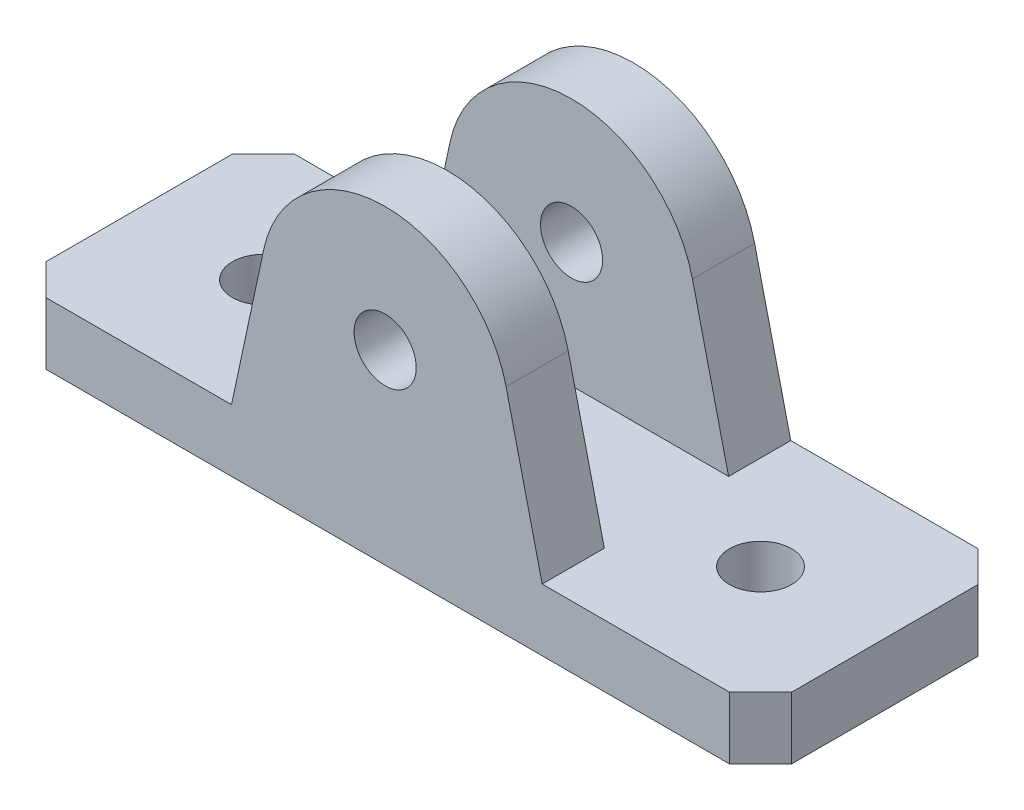
from build123d import *

# Parameters (mm, degrees)
SKETCH1_W           = 120
SKETCH1_H           = 40
BOSS_EXTRUDE1_DEPTH = 10
SKETCH2_R           = 5
BOSS_EXTRUDE2_DEPTH = 10
CHAMFER1_SIZE       = 5
SKETCH3_R           = 5
CUT_EXTRUDE1_DEPTH  = 75.833147735
SCALE2_SCALE        = 0.5


with BuildPart() as part:
    # Sketch1 → Boss-Extrude1 (new body)
    with BuildSketch(Plane(origin=(0, 0, 0), x_dir=(1, 0, 0), z_dir=(0, 1, 0))):
        Rectangle(SKETCH1_W, SKETCH1_H)
    extrude(amount=BOSS_EXTRUDE1_DEPTH)

    # Sketch2 → Boss-Extrude2 (add)
    with BuildSketch(Plane.XY.offset(20)):
        with BuildLine():
            Line((-19.976236617, 34.176742213), (-25.139075945, 10))
            Line((-25.139075945, 10), (24.860924055, 10))
            Line((24.860924055, 10), (19.046500931, 34.600354606))
            ThreePointArc((19.046500931, 34.600354606), (-0.634325591, 49.998821679), (-19.976236617, 34.176742213))
        make_face()
        with Locations((-0.417227836, 30)):
            Circle(SKETCH2_R, mode=Mode.SUBTRACT)
    boss_extrude2 = extrude(amount=-BOSS_EXTRUDE2_DEPTH)

    # Mirror1: Boss-Extrude2 across plane
    add(boss_extrude2.mirror(Plane.XY))

    # Chamfer1
    chamfer1_edges = [part.edges().sort_by_distance(p)[0] for p in [
        (-60, 5, -20),
        (60, 5, -20),
        (60, 5, 20),
        (-60, 5, 20),
    ]]
    chamfer(chamfer1_edges, length=CHAMFER1_SIZE)

    # Sketch3 → Cut-Extrude1 (cut, through all)
    with BuildSketch(Plane(origin=(0, 10, 0), x_dir=(1, 0, 0), z_dir=(0, 1, 0))):
        with Locations(Location((40, 0, 0), (0, 0, 270))):
            Circle(SKETCH3_R)
        with Locations(Location((-40, 0, 0), (0, 0, 90))):
            Circle(SKETCH3_R)
    extrude(amount=-CUT_EXTRUDE1_DEPTH, mode=Mode.SUBTRACT)


with BuildPart() as part_1:
    # Scale2: scaled about (-0.120416424, 13.6400035, 0)
    add(part.part.scale(SCALE2_SCALE).moved(Location((-0.060208212, 6.82000175, 0))))


solid = part_1.part
